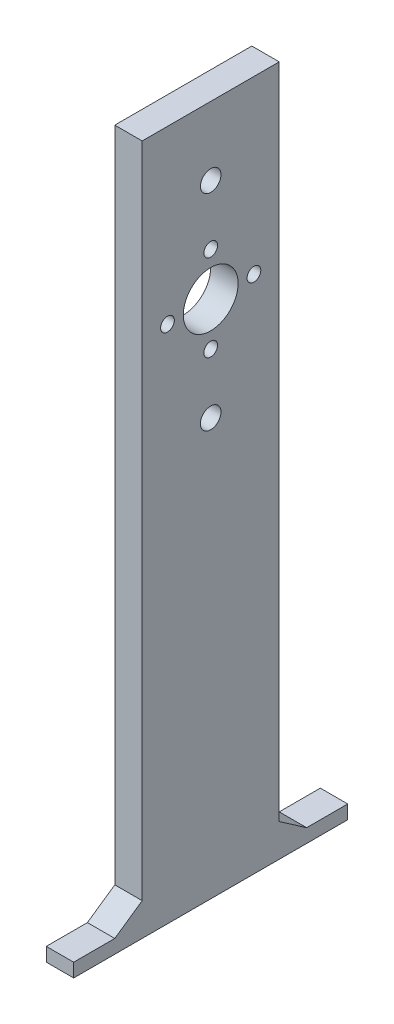
from build123d import *

# Parameters (mm, degrees)
BOSS_EXTRUDE1_DEPTH = 252
CUT_EXTRUDE2_DEPTH  = 10
SKETCH4_W           = 25
SKETCH4_H           = 52
CUT_EXTRUDE3_DEPTH  = 10
SKETCH5_R           = 3.75
SKETCH5_R_2         = 10
CUT_EXTRUDE5_DEPTH  = 264.114043715
SKETCH6_R           = 2.5
CUT_EXTRUDE6_DEPTH  = 264.114043715


with BuildPart() as part:
    # Sketch1 → Boss-Extrude1 (new body)
    with BuildSketch(Plane(origin=(0, 0, 0), x_dir=(1, 0, 0), z_dir=(0, 1, 0))):
        Polygon((10, 0), (10, 50), (10, 75), (0, 75), (0, 50), (0, 0), (0, -25), (10, -25), align=None)
    extrude(amount=BOSS_EXTRUDE1_DEPTH)

    # Sketch3 → Cut-Extrude2 (cut)
    with BuildSketch(Plane.ZY):
        Polygon((25, 200), (25, 5), (10, 5), (0, 11.937821542), (0, 200), align=None)
        Polygon((-75, 5), (-60, 5), (-50, 11.937821542), (-50, 252), (-75, 252), align=None)
    extrude(amount=-CUT_EXTRUDE2_DEPTH, mode=Mode.SUBTRACT)

    # Sketch4 → Cut-Extrude3 (cut)
    with BuildSketch(Plane(origin=(10, 0, 0), x_dir=(0, 0, -1), z_dir=(1, 0, 0))):
        with Locations((-12.5, 226)):
            Rectangle(SKETCH4_W, SKETCH4_H)
    extrude(amount=-CUT_EXTRUDE3_DEPTH, mode=Mode.SUBTRACT)

    # Sketch5 → Cut-Extrude5 (cut, through all)
    with BuildSketch(Plane(origin=(10, 0, 0), x_dir=(0, 0, -1), z_dir=(1, 0, 0))):
        with Locations((25, 227)):
            Circle(SKETCH5_R)
        with Locations((25, 189.5)):
            Circle(SKETCH5_R_2)
        with Locations(Location((25, 152, 0), (0, 0, 180))):
            Circle(SKETCH5_R)
    extrude(amount=-CUT_EXTRUDE5_DEPTH, mode=Mode.SUBTRACT)

    # Sketch6 → Cut-Extrude6 (cut, through all)
    with BuildSketch(Plane.ZY):
        with Locations((-40.77, 189.5)):
            Circle(SKETCH6_R)
        with Locations(Location((-9.23, 189.5, 0), (0, 0, 180))):
            Circle(SKETCH6_R)
        with Locations((-25, 205.27)):
            Circle(SKETCH6_R)
        with Locations(Location((-25, 173.73, 0), (0, 0, 180))):
            Circle(SKETCH6_R)
    extrude(amount=-CUT_EXTRUDE6_DEPTH, mode=Mode.SUBTRACT)


solid = part.part
